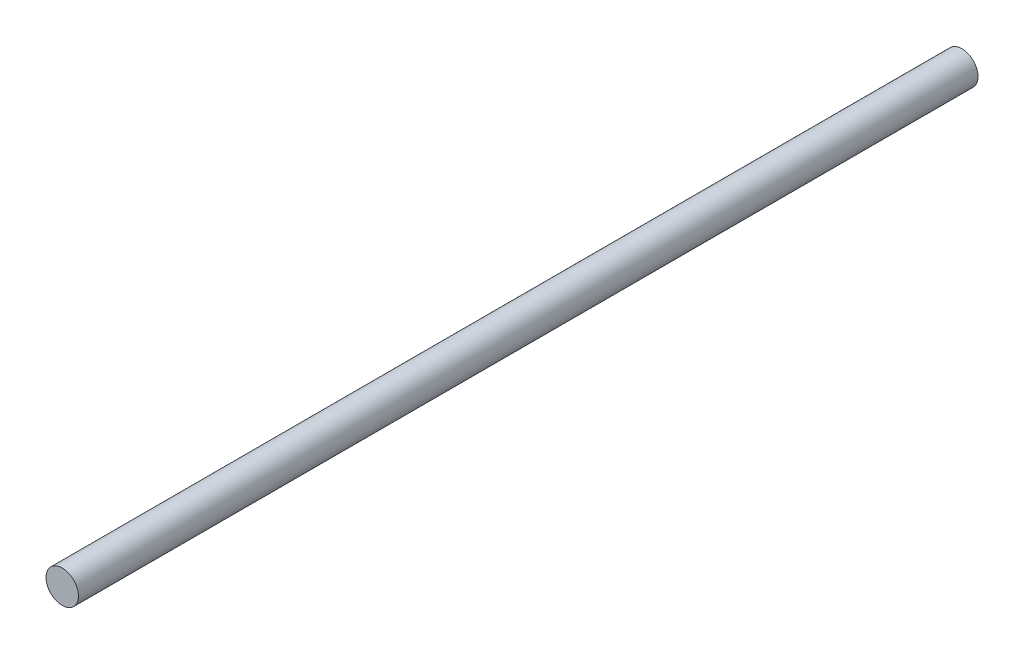
from build123d import *

# Parameters (mm, degrees)
SKETCH1_R           = 3.5
BOSS_EXTRUDE1_DEPTH = 194


with BuildPart() as part:
    # Sketch1 → Boss-Extrude1 (new body)
    with BuildSketch(Plane.XY):
        with Locations(Location((0, 0, 0), (0, 0, 180))):
            Circle(SKETCH1_R)
    extrude(amount=BOSS_EXTRUDE1_DEPTH)


solid = part.part
